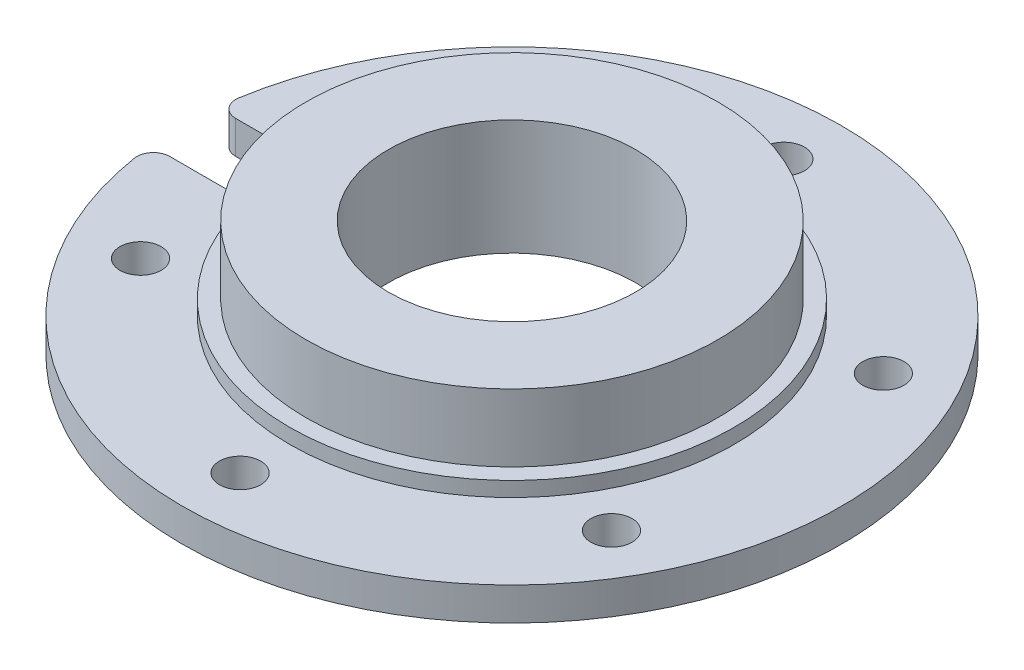
from build123d import *

# Parameters (mm, degrees)
SKETCH_1_R          = 20
SKETCH_1_R_2        = 7.5
SKETCH_1_R_3        = 1
EXTRUDE_1_DEPTH     = 2
SKETCH_2_R          = 12.5
SKETCH_2_R_2        = 7.5
EXTRUDE_2_DEPTH     = 5
SKETCH_3_R          = 13.5
SKETCH_3_R_2        = 12.5
EXTRUDE_3_DEPTH     = 0.9
SKETCH_4_W          = 9.188934261
SKETCH_4_H          = 4
CUT_EXTRUDE_1_DEPTH = 10
FILLET_1_R          = 1
HOLE_WIZARD_M3_1_D  = 2.5


with BuildPart() as part:
    # 草图1 → 凸台-拉伸1 (new body)
    with BuildSketch(Plane(origin=(0, 0, 0), x_dir=(1, 0, 0), z_dir=(0, 1, 0))):
        with Locations(Location((0, 0, 0), (0, 0, 270))):
            Circle(SKETCH_1_R)
        with Locations(Location((0, 0, 0), (0, 0, 270))):
            Circle(SKETCH_1_R_2, mode=Mode.SUBTRACT)
        with Locations(Location((0, 16.5, 0), (0, 0, 270))):
            Circle(SKETCH_1_R_3, mode=Mode.SUBTRACT)
        with Locations(Location((14.289419162, 8.25, 0), (0, 0, 270))):
            Circle(SKETCH_1_R_3, mode=Mode.SUBTRACT)
        with Locations(Location((14.289419162, -8.25, 0), (0, 0, 270))):
            Circle(SKETCH_1_R_3, mode=Mode.SUBTRACT)
        with Locations(Location((0, -16.5, 0), (0, 0, 270))):
            Circle(SKETCH_1_R_3, mode=Mode.SUBTRACT)
        with Locations(Location((-14.289419162, -8.25, 0), (0, 0, 270))):
            Circle(SKETCH_1_R_3, mode=Mode.SUBTRACT)
        with Locations(Location((-14.289419162, 8.25, 0), (0, 0, 270))):
            Circle(SKETCH_1_R_3, mode=Mode.SUBTRACT)
    extrude(amount=EXTRUDE_1_DEPTH)

    # 草图2 → 凸台-拉伸2 (add)
    with BuildSketch(Plane(origin=(0, 2, 0), x_dir=(1, 0, 0), z_dir=(0, 1, 0))):
        with Locations(Location((0, 0, 0), (0, 0, 270))):
            Circle(SKETCH_2_R)
        with Locations(Location((0, 0, 0), (0, 0, 270))):
            Circle(SKETCH_2_R_2, mode=Mode.SUBTRACT)
    extrude(amount=EXTRUDE_2_DEPTH)

    # 草图3 → 凸台-拉伸3 (add)
    with BuildSketch(Plane(origin=(0, 2, 0), x_dir=(1, 0, 0), z_dir=(0, 1, 0))):
        with Locations(Location((0, 0, 0), (0, 0, 270))):
            Circle(SKETCH_3_R)
        with Locations(Location((0, 0, 0), (0, 0, 270))):
            Circle(SKETCH_3_R_2, mode=Mode.SUBTRACT)
    extrude(amount=EXTRUDE_3_DEPTH)

    # 草图4 → 切除-拉伸1 (cut)
    with BuildSketch(Plane.XZ):
        with Locations((-18.59446713, 0)):
            Rectangle(SKETCH_4_W, SKETCH_4_H)
    extrude(amount=-CUT_EXTRUDE_1_DEPTH, mode=Mode.SUBTRACT)

    # 圆角1
    fillet_1_edges = [part.edges().sort_by_distance(p)[0] for p in [
        (-19.899748742, 1, -2),
        (-19.899748742, 1, 2),
        (-14, 1, 2),
        (-14, 1, -2),
    ]]
    fillet(fillet_1_edges, radius=FILLET_1_R)

    # M3 螺纹孔1 (through all)
    with Locations(Plane.XZ):
        with Locations((-14.289419162, 8.25), (0, 16.5), (14.289419162, 8.25), (14.289419162, -8.25), (0, -16.5), (-14.289419162, -8.25)):
            Hole(HOLE_WIZARD_M3_1_D / 2)


solid = part.part
